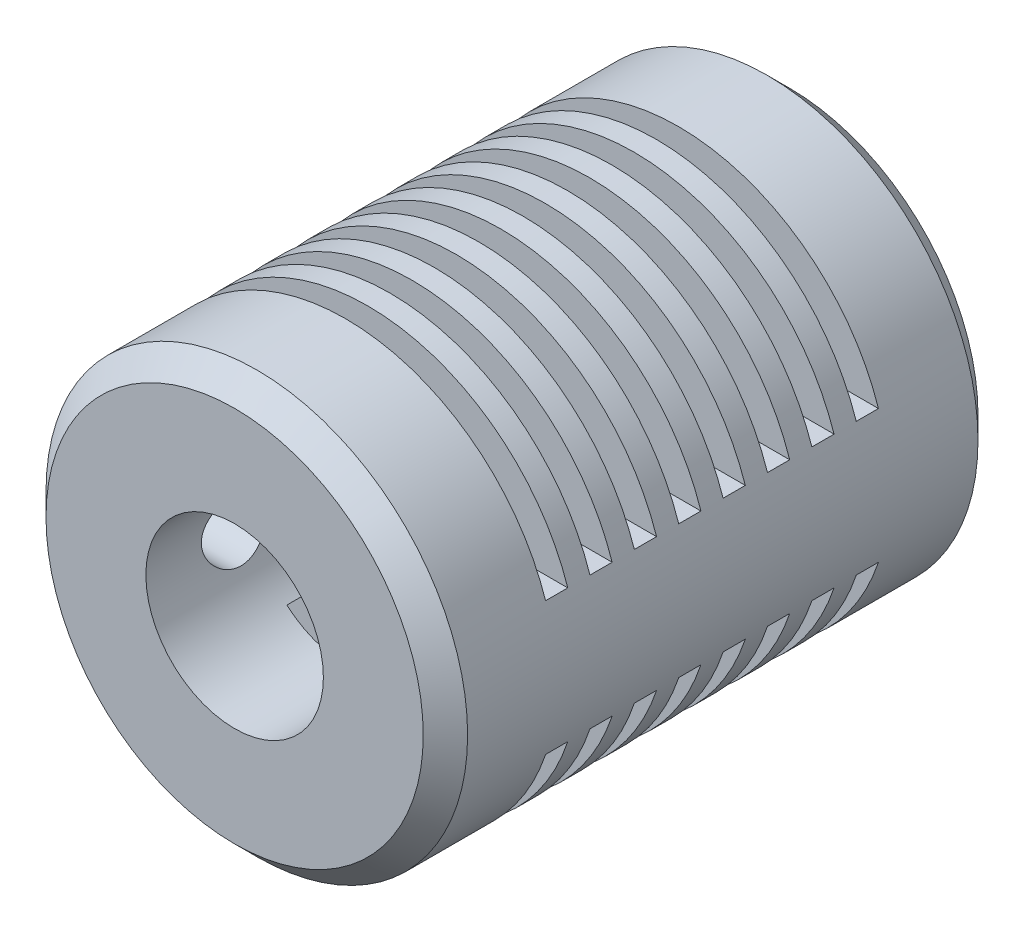
from build123d import *

# Parameters (mm, degrees)
CROQUIS1_R                 = 9.5
SALIENTE_EXTRUIR1_DEPTH    = 25
CROQUIS2_R                 = 2.5
CORTAR_EXTRUIR1_DEPTH      = 29.381331893
CROQUIS3_R                 = 4
CORTAR_EXTRUIR2_DEPTH      = 17
CHAFL_N1_SIZE              = 1
CROQUIS4_R                 = 1.5
CORTAR_EXTRUIR3_DEPTH      = 29.381331893
CORTAR_EXTRUIR4_DEPTH      = 29.381332048
CORTAR_EXTRUIR4_DEPTH_BACK = 29.381332048
CROQUIS5_W                 = 1
CROQUIS5_H                 = 8


with BuildPart() as part:
    # Croquis1 → Saliente-Extruir1 (new body)
    with BuildSketch(Plane.XY):
        Circle(CROQUIS1_R)
    extrude(amount=SALIENTE_EXTRUIR1_DEPTH)

    # Croquis2 → Cortar-Extruir1 (cut, through all)
    with BuildSketch(Plane.XY.offset(25)):
        Circle(CROQUIS2_R)
    extrude(amount=-CORTAR_EXTRUIR1_DEPTH, mode=Mode.SUBTRACT)

    # Croquis3 → Cortar-Extruir2 (cut)
    with BuildSketch(Plane.XY.offset(25)):
        Circle(CROQUIS3_R)
    extrude(amount=-CORTAR_EXTRUIR2_DEPTH, mode=Mode.SUBTRACT)

    # Chaflán1
    chafl_n1_edges = [part.edges().sort_by_distance(p)[0] for p in [
        (-9.5, 0, 0),
        (-9.5, 0, 25),
    ]]
    chamfer(chafl_n1_edges, length=CHAFL_N1_SIZE)

    # Croquis4 → Cortar-Extruir3 (cut, through all)
    with BuildSketch(Plane(origin=(0, 0, 0), x_dir=(0, 0, -1), z_dir=(1, 0, 0))):
        with Locations((-21, 0)):
            Circle(CROQUIS4_R)
        with Locations((-4, 0)):
            Circle(CROQUIS4_R)
    extrude(amount=-CORTAR_EXTRUIR3_DEPTH, mode=Mode.SUBTRACT)

    # Croquis5 → Cortar-Extruir4 (cut, two sides: drawn at the far end of the back side and taken through both)
    with BuildSketch(Plane(origin=(0, 0, 0), x_dir=(0, 0, -1), z_dir=(1, 0, 0)).offset(-CORTAR_EXTRUIR4_DEPTH_BACK)):
        with Locations((-17.5, 7)):
            Rectangle(CROQUIS5_W, CROQUIS5_H)
        with Locations((-19.5, 7)):
            Rectangle(CROQUIS5_W, CROQUIS5_H)
        with Locations((-15.5, 7)):
            Rectangle(CROQUIS5_W, CROQUIS5_H)
        with Locations((-13.5, 7)):
            Rectangle(CROQUIS5_W, CROQUIS5_H)
        with Locations((-11.5, 7)):
            Rectangle(CROQUIS5_W, CROQUIS5_H)
        with Locations((-9.5, 7)):
            Rectangle(CROQUIS5_W, CROQUIS5_H)
        with Locations((-7.5, 7)):
            Rectangle(CROQUIS5_W, CROQUIS5_H)
        with Locations((-5.5, 7)):
            Rectangle(CROQUIS5_W, CROQUIS5_H)
        with Locations((-17.5, -7)):
            Rectangle(CROQUIS5_W, CROQUIS5_H)
        with Locations((-15.5, -7)):
            Rectangle(CROQUIS5_W, CROQUIS5_H)
        with Locations((-13.5, -7)):
            Rectangle(CROQUIS5_W, CROQUIS5_H)
        with Locations((-11.5, -7)):
            Rectangle(CROQUIS5_W, CROQUIS5_H)
        with Locations((-9.5, -7)):
            Rectangle(CROQUIS5_W, CROQUIS5_H)
        with Locations((-7.5, -7)):
            Rectangle(CROQUIS5_W, CROQUIS5_H)
        with Locations((-5.5, -7)):
            Rectangle(CROQUIS5_W, CROQUIS5_H)
        with Locations((-19.5, -7)):
            Rectangle(CROQUIS5_W, CROQUIS5_H)
    extrude(amount=CORTAR_EXTRUIR4_DEPTH + CORTAR_EXTRUIR4_DEPTH_BACK, mode=Mode.SUBTRACT)


solid = part.part
